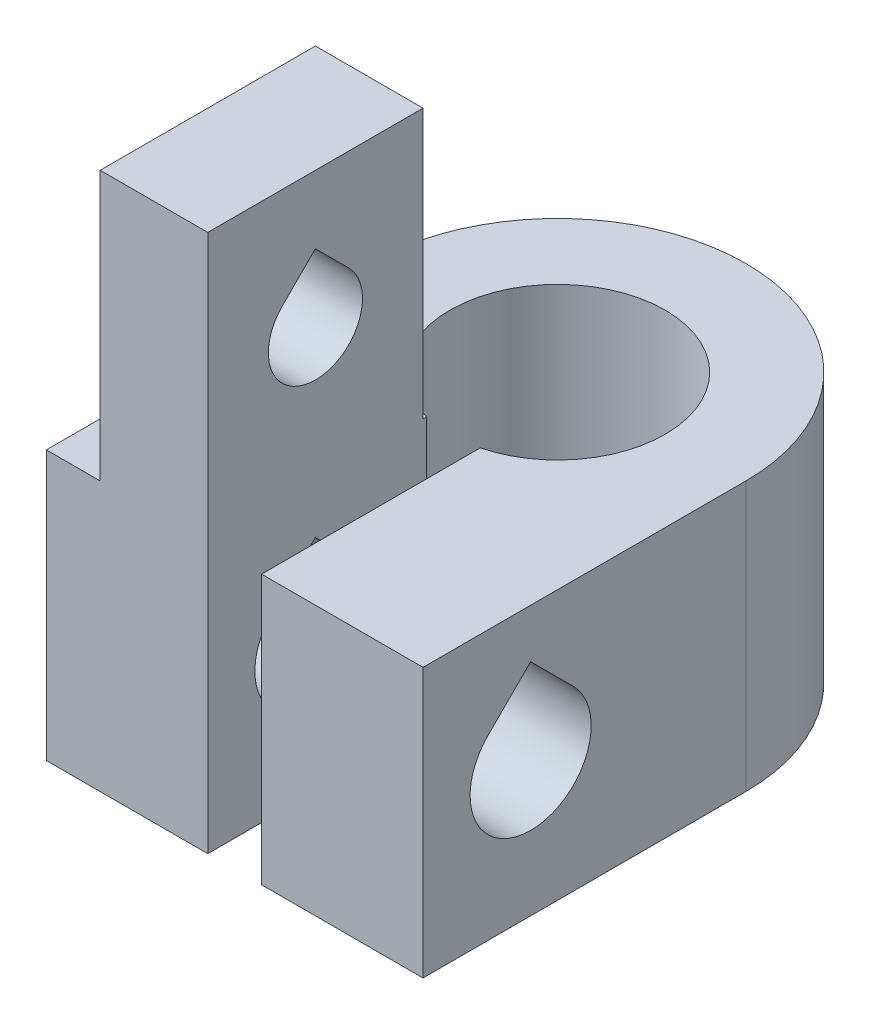
from build123d import *

# Parameters (mm, degrees)
BOSS_EXTRUDE1_DEPTH = 20
CUT_EXTRUDE1_DEPTH  = 28.202941017
CUT_EXTRUDE2_DEPTH  = 10
CUT_EXTRUDE3_DEPTH  = 10
SKETCH5_W           = 8
SKETCH5_H           = 10
CUT_EXTRUDE4_DEPTH  = 2


with BuildPart() as part:
    # Sketch1 → Boss-Extrude1 (new body)
    with BuildSketch(Plane(origin=(0, 0, 0), x_dir=(1, 0, 0), z_dir=(0, 1, 0))):
        with BuildLine():
            Line((-7, -12), (-7, 0))
            ThreePointArc((-7, 0), (0, 7), (7, 0))
            Line((7, 0), (7, -12))
            Line((7, -12), (1, -12))
            Line((1, -12), (1, -3.872983346))
            ThreePointArc((1, -3.872983346), (0, 4), (-1, -3.872983346))
            Line((-1, -3.872983346), (-1, -12))
            Line((-1, -12), (-7, -12))
        make_face()
    extrude(amount=BOSS_EXTRUDE1_DEPTH)

    # Sketch2 → Cut-Extrude1 (cut, through all)
    with BuildSketch(Plane.ZY.offset(7)):
        with BuildLine():
            Line((6.409009742, 6.590990258), (8, 8.181980515))
            Line((8, 8.181980515), (9.590990258, 6.590990258))
            ThreePointArc((9.590990258, 6.590990258), (8, 2.75), (6.409009742, 6.590990258))
        make_face()
    extrude(amount=-CUT_EXTRUDE1_DEPTH, mode=Mode.SUBTRACT)

    # Sketch3 → Cut-Extrude2 (cut)
    with BuildSketch(Plane(origin=(0, 20, 0), x_dir=(1, 0, 0), z_dir=(0, 1, 0))):
        Polygon((1, -4), (-7, -4), (-7, 7), (7, 7), (7, 0), (7, -12), (1, -12), align=None)
    extrude(amount=-CUT_EXTRUDE2_DEPTH, mode=Mode.SUBTRACT)

    # Sketch4 → Cut-Extrude3 (cut)
    with BuildSketch(Plane(origin=(-1, 0, 0), x_dir=(0, 0, -1), z_dir=(1, 0, 0))):
        with BuildLine():
            Line((-9.237436867, 16.237436867), (-8, 17.474873734))
            Line((-8, 17.474873734), (-6.762563133, 16.237436867))
            ThreePointArc((-6.762563133, 16.237436867), (-8, 13.25), (-9.237436867, 16.237436867))
        make_face()
    extrude(amount=-CUT_EXTRUDE3_DEPTH, mode=Mode.SUBTRACT)

    # Sketch5 → Cut-Extrude4 (cut)
    with BuildSketch(Plane.ZY.offset(7)):
        with Locations((8, 15)):
            Rectangle(SKETCH5_W, SKETCH5_H)
    extrude(amount=-CUT_EXTRUDE4_DEPTH, mode=Mode.SUBTRACT)


solid = part.part
